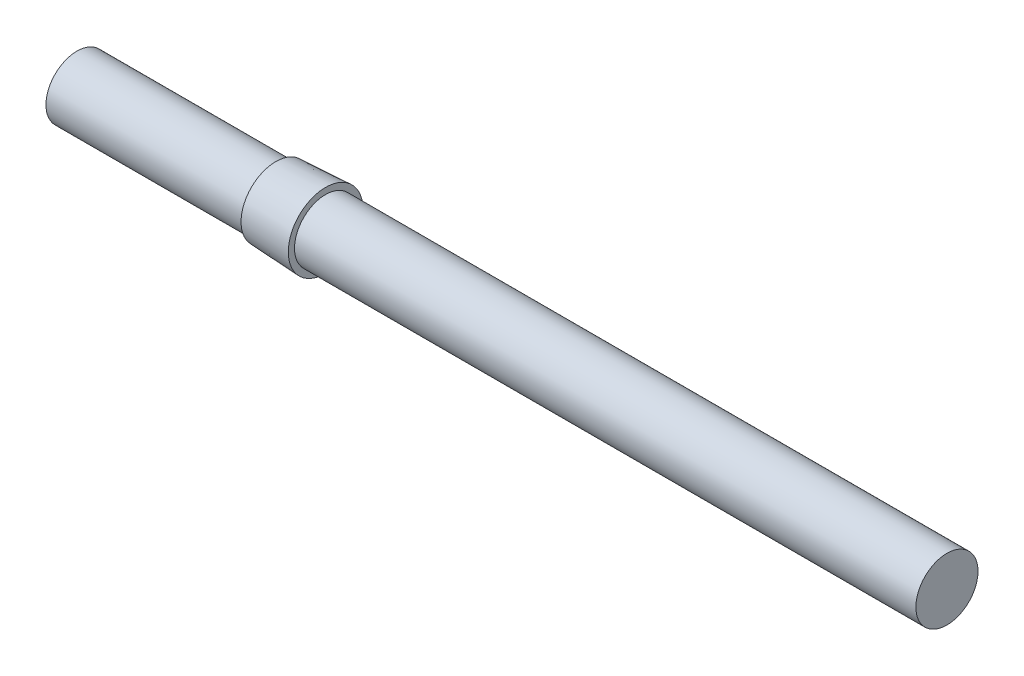
from build123d import *

# Parameters (mm, degrees)
SKETCH1_R           = 12.5
BOSS_EXTRUDE1_DEPTH = 350
SKETCH3_R           = 15
SKETCH2_R           = 14
SKETCH4_W           = 8
SKETCH4_H           = 37
CUT_EXTRUDE2_DEPTH  = 7


with BuildPart() as part:
    # Sketch1 → Boss-Extrude1 (new body)
    with BuildSketch(Plane.YZ):
        with Locations(Location((0, 0, 0), (0, 0, 270))):
            Circle(SKETCH1_R)
    extrude(amount=BOSS_EXTRUDE1_DEPTH)

    # Sketch3 → Loft1 section 0
    with BuildSketch(Plane.YZ.offset(100)):
        Circle(SKETCH3_R)
    # Sketch2 → Loft1 section 1
    with BuildSketch(Plane.YZ.offset(80)):
        Circle(SKETCH2_R)
    loft()

    # Sketch4 → Cut-Extrude2 (cut)
    with BuildSketch(Plane(origin=(0, 0, 10), x_dir=(0, 1, 0), z_dir=(0, 0, 1))):
        with Locations((0.007753839, -118.5)):
            Rectangle(SKETCH4_W, SKETCH4_H)
    extrude(amount=-CUT_EXTRUDE2_DEPTH, mode=Mode.SUBTRACT)


solid = part.part
